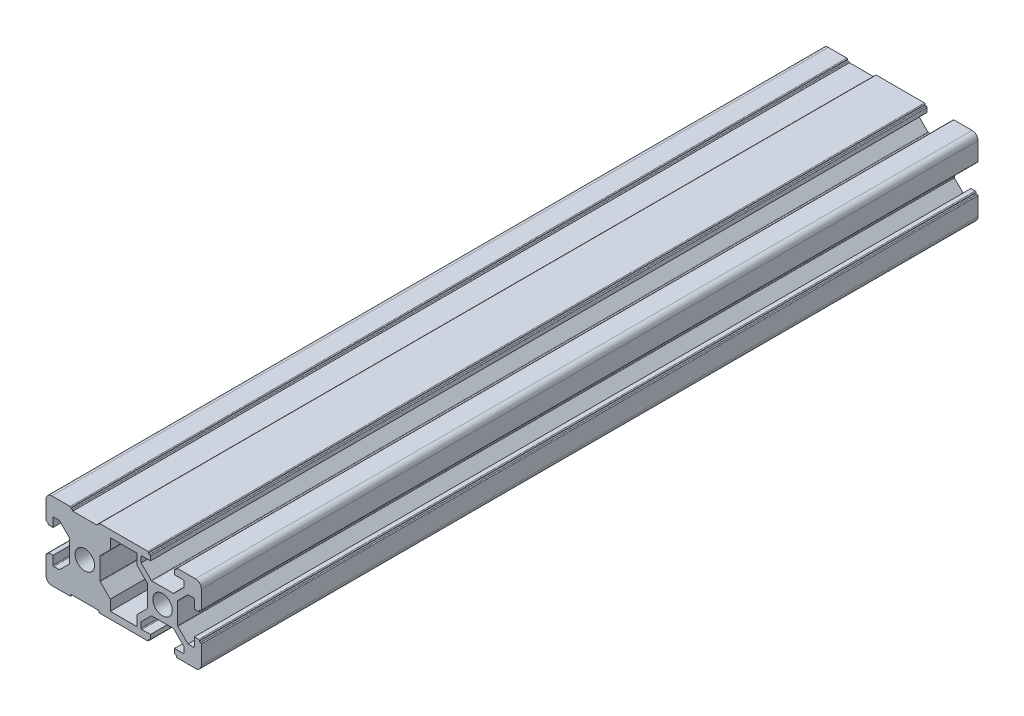
from build123d import *

# Parameters (mm, degrees)
BOSS_EXTRUDE1_DEPTH = 200
SKETCH2_R           = 2.5
CUT_EXTRUDE1_DEPTH  = 203.484567313


with BuildPart() as part:
    # Sketch1 → Boss-Extrude1 (new body)
    with BuildSketch(Plane.XY):
        with BuildLine():
            Line((-8.5, 10), (-3.8, 10))
            ThreePointArc((-3.8, 10), (-3.658578644, 9.941421356), (-3.6, 9.8))
            Line((-3.6, 9.8), (-3.6, 9.7))
            ThreePointArc((-3.6, 9.7), (-3.541421356, 9.558578644), (-3.4, 9.5))
            Line((-3.4, 9.5), (-3.3, 9.5))
            ThreePointArc((-3.3, 9.5), (-3.158578644, 9.441421356), (-3.1, 9.3))
            Line((-3.1, 9.3), (3.1, 9.3))
            ThreePointArc((3.1, 9.3), (3.158578644, 9.441421356), (3.3, 9.5))
            Line((3.3, 9.5), (3.4, 9.5))
            ThreePointArc((3.4, 9.5), (3.541421356, 9.558578644), (3.6, 9.7))
            Line((3.6, 9.7), (3.6, 9.8))
            ThreePointArc((3.6, 9.8), (3.658578644, 9.941421356), (3.8, 10))
            Line((3.8, 10), (8.5, 10))
            Line((8.5, 10), (11.5, 10))
            Line((11.5, 10), (16.2, 10))
            ThreePointArc((16.2, 10), (16.341421356, 9.941421356), (16.4, 9.8))
            Line((16.4, 9.8), (16.4, 9.7))
            ThreePointArc((16.4, 9.7), (16.458578644, 9.558578644), (16.6, 9.5))
            Line((16.6, 9.5), (16.7, 9.5))
            ThreePointArc((16.7, 9.5), (16.841421356, 9.441421356), (16.9, 9.3))
            Line((16.9, 9.3), (16.9, 8.2))
            Line((16.9, 8.2), (14.7, 8.2))
            ThreePointArc((14.7, 8.2), (14.558578644, 8.141421356), (14.5, 8))
            Line((14.5, 8), (14.5, 6.560660172))
            Line((14.5, 6.560660172), (17.102081528, 3.958578644))
            ThreePointArc((17.102081528, 3.958578644), (17.166966198, 3.915224093), (17.243502884, 3.9))
            Line((17.243502884, 3.9), (22.756497116, 3.9))
            ThreePointArc((22.756497116, 3.9), (22.833033802, 3.915224093), (22.897918472, 3.958578644))
            Line((22.897918472, 3.958578644), (25.5, 6.560660172))
            Line((25.5, 6.560660172), (25.5, 8))
            ThreePointArc((25.5, 8), (25.441421356, 8.141421356), (25.3, 8.2))
            Line((25.3, 8.2), (23.1, 8.2))
            Line((23.1, 8.2), (23.1, 9.3))
            ThreePointArc((23.1, 9.3), (23.158578644, 9.441421356), (23.3, 9.5))
            Line((23.3, 9.5), (23.4, 9.5))
            ThreePointArc((23.4, 9.5), (23.541421356, 9.558578644), (23.6, 9.7))
            Line((23.6, 9.7), (23.6, 9.8))
            ThreePointArc((23.6, 9.8), (23.658578644, 9.941421356), (23.8, 10))
            Line((23.8, 10), (28.5, 10))
            ThreePointArc((28.5, 10), (29.560660172, 9.560660172), (30, 8.5))
            Line((30, 8.5), (30, 3.8))
            ThreePointArc((30, 3.8), (29.941421356, 3.658578644), (29.8, 3.6))
            Line((29.8, 3.6), (29.7, 3.6))
            ThreePointArc((29.7, 3.6), (29.558578644, 3.541421356), (29.5, 3.4))
            Line((29.5, 3.4), (29.5, 3.3))
            ThreePointArc((29.5, 3.3), (29.441421356, 3.158578644), (29.3, 3.1))
            Line((29.3, 3.1), (28.2, 3.1))
            Line((28.2, 3.1), (28.2, 5.3))
            ThreePointArc((28.2, 5.3), (28.141421356, 5.441421356), (28, 5.5))
            Line((28, 5.5), (26.560660172, 5.5))
            Line((26.560660172, 5.5), (23.958578644, 2.897918472))
            ThreePointArc((23.958578644, 2.897918472), (23.915224093, 2.833033802), (23.9, 2.756497116))
            Line((23.9, 2.756497116), (23.9, -2.756497116))
            ThreePointArc((23.9, -2.756497116), (23.915224093, -2.833033802), (23.958578644, -2.897918472))
            Line((23.958578644, -2.897918472), (26.560660172, -5.5))
            Line((26.560660172, -5.5), (28, -5.5))
            ThreePointArc((28, -5.5), (28.141421356, -5.441421356), (28.2, -5.3))
            Line((28.2, -5.3), (28.2, -3.1))
            Line((28.2, -3.1), (29.3, -3.1))
            ThreePointArc((29.3, -3.1), (29.441421356, -3.158578644), (29.5, -3.3))
            Line((29.5, -3.3), (29.5, -3.4))
            ThreePointArc((29.5, -3.4), (29.558578644, -3.541421356), (29.7, -3.6))
            Line((29.7, -3.6), (29.8, -3.6))
            ThreePointArc((29.8, -3.6), (29.941421356, -3.658578644), (30, -3.8))
            Line((30, -3.8), (30, -8.5))
            ThreePointArc((30, -8.5), (29.560660172, -9.560660172), (28.5, -10))
            Line((28.5, -10), (23.8, -10))
            ThreePointArc((23.8, -10), (23.658578644, -9.941421356), (23.6, -9.8))
            Line((23.6, -9.8), (23.6, -9.7))
            ThreePointArc((23.6, -9.7), (23.541421356, -9.558578644), (23.4, -9.5))
            Line((23.4, -9.5), (23.3, -9.5))
            ThreePointArc((23.3, -9.5), (23.158578644, -9.441421356), (23.1, -9.3))
            Line((23.1, -9.3), (23.1, -8.2))
            Line((23.1, -8.2), (25.3, -8.2))
            ThreePointArc((25.3, -8.2), (25.441421356, -8.141421356), (25.5, -8))
            Line((25.5, -8), (25.5, -6.560660172))
            Line((25.5, -6.560660172), (22.897918472, -3.958578644))
            ThreePointArc((22.897918472, -3.958578644), (22.833033802, -3.915224093), (22.756497116, -3.9))
            Line((22.756497116, -3.9), (17.243502884, -3.9))
            ThreePointArc((17.243502884, -3.9), (17.166966198, -3.915224093), (17.102081528, -3.958578644))
            Line((17.102081528, -3.958578644), (14.5, -6.560660172))
            Line((14.5, -6.560660172), (14.5, -8))
            ThreePointArc((14.5, -8), (14.558578644, -8.141421356), (14.7, -8.2))
            Line((14.7, -8.2), (16.9, -8.2))
            Line((16.9, -8.2), (16.9, -9.3))
            ThreePointArc((16.9, -9.3), (16.841421356, -9.441421356), (16.7, -9.5))
            Line((16.7, -9.5), (16.6, -9.5))
            ThreePointArc((16.6, -9.5), (16.458578644, -9.558578644), (16.4, -9.7))
            Line((16.4, -9.7), (16.4, -9.8))
            ThreePointArc((16.4, -9.8), (16.341421356, -9.941421356), (16.2, -10))
            Line((16.2, -10), (11.5, -10))
            Line((11.5, -10), (8.5, -10))
            Line((8.5, -10), (3.8, -10))
            ThreePointArc((3.8, -10), (3.658578644, -9.941421356), (3.6, -9.8))
            Line((3.6, -9.8), (3.6, -9.7))
            ThreePointArc((3.6, -9.7), (3.541421356, -9.558578644), (3.4, -9.5))
            Line((3.4, -9.5), (3.3, -9.5))
            Line((3.3, -9.5), (-3.3, -9.5))
            Line((-3.3, -9.5), (-3.4, -9.5))
            ThreePointArc((-3.4, -9.5), (-3.541421356, -9.558578644), (-3.6, -9.7))
            Line((-3.6, -9.7), (-3.6, -9.8))
            ThreePointArc((-3.6, -9.8), (-3.658578644, -9.941421356), (-3.8, -10))
            Line((-3.8, -10), (-8.5, -10))
            ThreePointArc((-8.5, -10), (-9.560660172, -9.560660172), (-10, -8.5))
            Line((-10, -8.5), (-10, -3.8))
            ThreePointArc((-10, -3.8), (-9.941421356, -3.658578644), (-9.8, -3.6))
            Line((-9.8, -3.6), (-9.7, -3.6))
            ThreePointArc((-9.7, -3.6), (-9.558578644, -3.541421356), (-9.5, -3.4))
            Line((-9.5, -3.4), (-9.5, -3.3))
            ThreePointArc((-9.5, -3.3), (-9.441421356, -3.158578644), (-9.3, -3.1))
            Line((-9.3, -3.1), (-8.2, -3.1))
            Line((-8.2, -3.1), (-8.2, -5.3))
            ThreePointArc((-8.2, -5.3), (-8.141421356, -5.441421356), (-8, -5.5))
            Line((-8, -5.5), (-6.560660172, -5.5))
            Line((-6.560660172, -5.5), (-3.958578644, -2.897918472))
            ThreePointArc((-3.958578644, -2.897918472), (-3.915224093, -2.833033802), (-3.9, -2.756497116))
            Line((-3.9, -2.756497116), (-3.9, 2.756497116))
            ThreePointArc((-3.9, 2.756497116), (-3.915224093, 2.833033802), (-3.958578644, 2.897918472))
            Line((-3.958578644, 2.897918472), (-6.560660172, 5.5))
            Line((-6.560660172, 5.5), (-8, 5.5))
            ThreePointArc((-8, 5.5), (-8.141421356, 5.441421356), (-8.2, 5.3))
            Line((-8.2, 5.3), (-8.2, 3.1))
            Line((-8.2, 3.1), (-9.3, 3.1))
            ThreePointArc((-9.3, 3.1), (-9.441421356, 3.158578644), (-9.5, 3.3))
            Line((-9.5, 3.3), (-9.5, 3.4))
            ThreePointArc((-9.5, 3.4), (-9.558578644, 3.541421356), (-9.7, 3.6))
            Line((-9.7, 3.6), (-9.8, 3.6))
            ThreePointArc((-9.8, 3.6), (-9.941421356, 3.658578644), (-10, 3.8))
            Line((-10, 3.8), (-10, 8.5))
            ThreePointArc((-10, 8.5), (-9.560660172, 9.560660172), (-8.5, 10))
        make_face()
        with BuildLine():
            Line((3.9, 2.756497116), (3.9, -2.756497116))
            ThreePointArc((3.9, -2.756497116), (3.915224093, -2.833033802), (3.958578644, -2.897918472))
            Line((3.958578644, -2.897918472), (6.560660172, -5.5))
            Line((6.560660172, -5.5), (6.560660172, -8.2))
            Line((6.560660172, -8.2), (13.439339828, -8.2))
            Line((13.439339828, -8.2), (13.439339828, -5.5))
            Line((13.439339828, -5.5), (16.041421356, -2.897918472))
            ThreePointArc((16.041421356, -2.897918472), (16.084775907, -2.833033802), (16.1, -2.756497116))
            Line((16.1, -2.756497116), (16.1, 2.756497116))
            ThreePointArc((16.1, 2.756497116), (16.084775907, 2.833033802), (16.041421356, 2.897918472))
            Line((16.041421356, 2.897918472), (13.439339828, 5.5))
            Line((13.439339828, 5.5), (13.439339828, 8.2))
            Line((13.439339828, 8.2), (6.560660172, 8.2))
            Line((6.560660172, 8.2), (6.560660172, 5.5))
            Line((6.560660172, 5.5), (3.958578644, 2.897918472))
            ThreePointArc((3.958578644, 2.897918472), (3.915224093, 2.833033802), (3.9, 2.756497116))
        make_face(mode=Mode.SUBTRACT)
    extrude(amount=BOSS_EXTRUDE1_DEPTH)

    # Sketch2 → Cut-Extrude1 (cut, through all)
    with BuildSketch(Plane.XY.offset(200)):
        Circle(SKETCH2_R)
        with Locations(Location((20, 0, 0), (0, 0, 180))):
            Circle(SKETCH2_R)
    extrude(amount=-CUT_EXTRUDE1_DEPTH, mode=Mode.SUBTRACT)


solid = part.part
